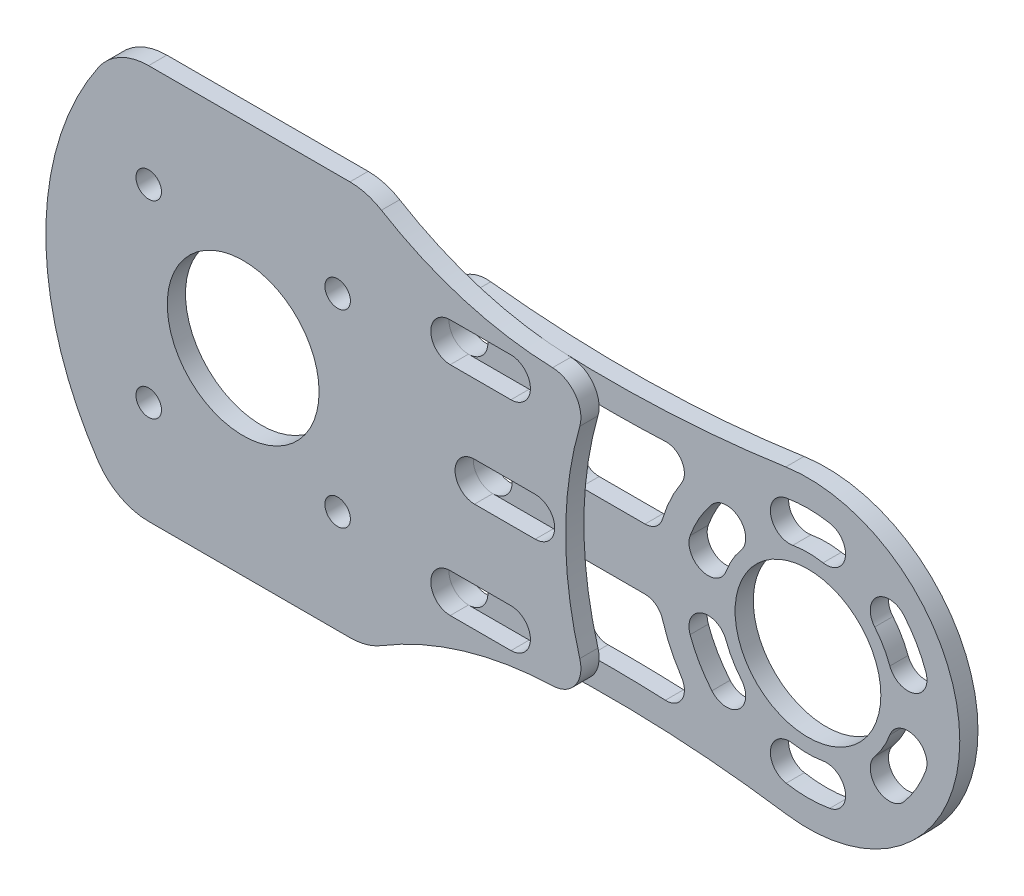
from build123d import *

# Parameters (mm, degrees)
SKETCH_2_R                  = 25
TRUCK_DEPTH                 = 3
SKETCH_1_R                  = 12
CUT_EXTRUDE_1_DEPTH         = 76.564788894
CUT_EXTRUDE_2_DEPTH         = 76.564788894
PATTERN_CIRCULAR_1_COUNT    = 6
FILLET_1_R                  = 6
HOLE_WIZARD_M6_1_D          = 6.4
MOTOR_DEPTH                 = 3
SKETCH_5_R                  = 12.5
CUT_EXTRUDE_3_DEPTH         = 3
SKETCH_7_W                  = 2.1
SKETCH_7_H                  = 3
HOLE_WIZARD_M4_1_AT_2_COUNT = 2
HOLE_WIZARD_M4_1_AT_2_PITCH = 31.112698372
HOLE_WIZARD_M4_1_AT_3_COUNT = 2
HOLE_WIZARD_M4_1_AT_3_PITCH = 44
HOLE_WIZARD_M4_1_AT_4_COUNT = 2
HOLE_WIZARD_M4_1_AT_4_PITCH = 31.112698372
CUT_EXTRUDE_START           = 3
CUT_EXTRUDE_4_DEPTH         = 3
CUT_EXTRUDE_START_2         = -3
CUT_EXTRUDE_5_DEPTH         = 3
FILLET_3_R                  = 3
FILLET_4_R                  = 10


with BuildPart() as part:
    # 스케치2 → Truck (new body)
    with BuildSketch(Plane.XY):
        Circle(SKETCH_2_R)
        with BuildLine():
            ThreePointArc((-3.649305556, -24.732217227), (-25, 0), (-3.649305556, 24.732217227))
            ThreePointArc((-3.649305556, 24.732217227), (-37.289980417, 22.639383563), (-70.804374003, 26.225520826))
            ThreePointArc((-70.804374003, 26.225520826), (-61.016316272, 14.703607637), (-57.5, 0))
            ThreePointArc((-57.5, 0), (-61.016316272, -14.703607637), (-70.804374003, -26.225520826))
            ThreePointArc((-70.804374003, -26.225520826), (-37.289980417, -22.639383563), (-3.649305556, -24.732217227))
        make_face()
    extrude(amount=TRUCK_DEPTH)

    # 스케치1 → 컷-돌출1 (cut, through all)
    with BuildSketch(Plane.XY):
        Circle(SKETCH_1_R)
    extrude(amount=CUT_EXTRUDE_1_DEPTH, mode=Mode.SUBTRACT)

    # 스케치3 → 컷-돌출2 (cut, through all)
    with BuildSketch(Plane.XY):
        with BuildLine():
            ThreePointArc((3.585834869, 20.3362801), (0, 20.65), (-3.585834869, 20.3362801))
            ThreePointArc((-3.585834869, 20.3362801), (-6.140987531, 16.687143918), (-2.49185135, 14.131991256))
            ThreePointArc((-2.49185135, 14.131991256), (0, 14.35), (2.49185135, 14.131991256))
            ThreePointArc((2.49185135, 14.131991256), (6.140987531, 16.687143918), (3.585834869, 20.3362801))
        make_face()
    cut_extrude_2 = extrude(amount=CUT_EXTRUDE_2_DEPTH, mode=Mode.SUBTRACT)

    # 원형 패턴1: 컷-돌출2 ×6 about axis
    pattern_circular_1_axis = Axis((0, 0, 0), (0, 0, 1))
    for i in range(1, PATTERN_CIRCULAR_1_COUNT):
        add(cut_extrude_2.rotate(pattern_circular_1_axis, i * 360 / PATTERN_CIRCULAR_1_COUNT), mode=Mode.SUBTRACT)

    # 필렛1
    fillet_1_edges = [part.edges().sort_by_distance(p)[0] for p in [
        (-70.804374003, -26.225520826, 1.5),
        (-70.804374003, 26.225520826, 1.5),
    ]]
    fillet(fillet_1_edges, radius=FILLET_1_R)

    # M6 여유 구멍1 (through all)
    with Locations(Plane(origin=(0, 0, 0), x_dir=(-1, 0, 0), z_dir=(0, 0, -1))):
        with Locations((55.906355956, 17.885005893), (55.906355956, -17.885005893), (51.906355956, 0)):
            Hole(HOLE_WIZARD_M6_1_D / 2)

    # 스케치14 → 컷-돌출5 (cut)
    with BuildSketch(Plane.XY.offset(3).offset(CUT_EXTRUDE_START_2)):
        with BuildLine():
            Line((-40.71074452, 5), (-24.494897428, 5))
            ThreePointArc((-24.494897428, 5), (-21.577058507, 12.626580938), (-16.357257436, 18.906087093))
            ThreePointArc((-16.357257436, 18.906087093), (-27.428944641, 18.311707589), (-38.51657268, 18.318709923))
            ThreePointArc((-38.51657268, 18.318709923), (-38.397916134, 18.001341359), (-38.420651285, 17.663280278))
            ThreePointArc((-38.420651285, 17.663280278), (-39.884787184, 11.389345899), (-40.71074452, 5))
        make_face()
        with BuildLine():
            ThreePointArc((-16.357257436, -18.906087093), (-21.577058507, -12.626580938), (-24.494897428, -5))
            Line((-24.494897428, -5), (-40.71074452, -5))
            ThreePointArc((-40.71074452, -5), (-39.884787184, -11.389345899), (-38.420651285, -17.663280278))
            ThreePointArc((-38.420651285, -17.663280278), (-38.397916134, -18.001341359), (-38.51657268, -18.318709923))
            ThreePointArc((-38.51657268, -18.318709923), (-27.428944641, -18.311707589), (-16.357257436, -18.906087093))
        make_face()
    extrude(amount=CUT_EXTRUDE_5_DEPTH, mode=Mode.SUBTRACT)

    # 필렛3
    fillet_3_edges = [part.edges().sort_by_distance(p)[0] for p in [
        (-24.494897428, -5, 1.5),
        (-16.357257436, -18.906087093, 1.5),
        (-24.494897428, 5, 1.5),
        (-16.357257436, 18.906087093, 1.5),
        (-40.71074452, 5, 1.5),
        (-38.51657268, -18.318709923, 1.5),
        (-40.71074452, -5, 1.5),
        (-38.51657268, 18.318709923, 1.5),
    ]]
    fillet(fillet_3_edges, radius=FILLET_3_R)


with BuildPart() as body_2:
    # 스케치4 → Motor (new body)
    with BuildSketch(Plane.XY.offset(3)):
        with BuildLine():
            Line((-110.496710384, 32.5), (-69.503289616, 32.5))
            ThreePointArc((-69.503289616, 32.5), (-54.966829019, 25.441496846), (-39.043925664, 22.68608359))
            ThreePointArc((-39.043925664, 22.68608359), (-35.311810207, 20.715230025), (-34.576007827, 16.559325261))
            ThreePointArc((-34.576007827, 16.559325261), (-36.906355956, 0), (-34.576007827, -16.559325261))
            ThreePointArc((-34.576007827, -16.559325261), (-35.311810207, -20.715230025), (-39.043925664, -22.68608359))
            ThreePointArc((-39.043925664, -22.68608359), (-54.966829019, -25.441496846), (-69.503289616, -32.5))
            Line((-69.503289616, -32.5), (-110.496710384, -32.5))
            ThreePointArc((-110.496710384, -32.5), (-122.5, 0), (-110.496710384, 32.5))
        make_face()
    extrude(amount=MOTOR_DEPTH)

    # 스케치5 → 컷-돌출3 (cut)
    with BuildSketch(Plane.XY.offset(3)):
        with Locations((-90, 0)):
            Circle(SKETCH_5_R)
    extrude(amount=CUT_EXTRUDE_3_DEPTH, mode=Mode.SUBTRACT)

    # 스케치7 → M4 여유 구멍1 (revolve, cut)
    with BuildSketch(Plane(origin=(-74.443650814, 15.556349186, 3), x_dir=(0, 1, 0), z_dir=(1, 0, 0))):
        with Locations((1.05, 1.5)):
            Rectangle(SKETCH_7_W, SKETCH_7_H)
    hole_wizard_m4_1 = revolve(axis=Axis((-74.443650814, 15.556349186, -3.35), (0, 0, 1)), mode=Mode.SUBTRACT)

    # M4 여유 구멍1 at 2: M4 여유 구멍1 ×2
    with Locations(*[(0, -i * HOLE_WIZARD_M4_1_AT_2_PITCH, 0) for i in range(1, HOLE_WIZARD_M4_1_AT_2_COUNT)]):
        add(hole_wizard_m4_1, mode=Mode.SUBTRACT)

    # M4 여유 구멍1 at 3: M4 여유 구멍1 ×2
    with Locations(*[Vector(-0.7071067811865474, -0.7071067811865477, 0) * (i * HOLE_WIZARD_M4_1_AT_3_PITCH) for i in range(1, HOLE_WIZARD_M4_1_AT_3_COUNT)]):
        add(hole_wizard_m4_1, mode=Mode.SUBTRACT)

    # M4 여유 구멍1 at 4: M4 여유 구멍1 ×2
    with Locations(*[(-i * HOLE_WIZARD_M4_1_AT_4_PITCH, 0, 0) for i in range(1, HOLE_WIZARD_M4_1_AT_4_COUNT)]):
        add(hole_wizard_m4_1, mode=Mode.SUBTRACT)

    # 스케치13 → 컷-돌출4 (cut)
    with BuildSketch(Plane.XY.offset(3).offset(CUT_EXTRUDE_START)):
        with BuildLine():
            Line((-45.906355956, 14.685005893), (-55.906355956, 14.685005893))
            ThreePointArc((-55.906355956, 14.685005893), (-59.106355956, 17.885005893), (-55.906355956, 21.085005893))
            Line((-55.906355956, 21.085005893), (-45.906355956, 21.085005893))
            ThreePointArc((-45.906355956, 21.085005893), (-42.706355956, 17.885005893), (-45.906355956, 14.685005893))
        make_face()
        with BuildLine():
            Line((-45.906355956, -21.085005893), (-55.906355956, -21.085005893))
            ThreePointArc((-55.906355956, -21.085005893), (-59.106355956, -17.885005893), (-55.906355956, -14.685005893))
            Line((-55.906355956, -14.685005893), (-45.906355956, -14.685005893))
            ThreePointArc((-45.906355956, -14.685005893), (-42.706355956, -17.885005893), (-45.906355956, -21.085005893))
        make_face()
        with BuildLine():
            Line((-41.906355956, -3.2), (-51.906355956, -3.2))
            ThreePointArc((-51.906355956, -3.2), (-55.106355956, 0), (-51.906355956, 3.2))
            Line((-51.906355956, 3.2), (-41.906355956, 3.2))
            ThreePointArc((-41.906355956, 3.2), (-38.706355956, 0), (-41.906355956, -3.2))
        make_face()
    extrude(amount=-CUT_EXTRUDE_4_DEPTH, mode=Mode.SUBTRACT)

    # 필렛4
    fillet_4_edges = [body_2.edges().sort_by_distance(p)[0] for p in [
        (-69.503289616, -32.5, 4.5),
        (-110.496710384, -32.5, 4.5),
        (-110.496710384, 32.5, 4.5),
        (-69.503289616, 32.5, 4.5),
    ]]
    fillet(fillet_4_edges, radius=FILLET_4_R)


solid = Compound([part.part, body_2.part])
